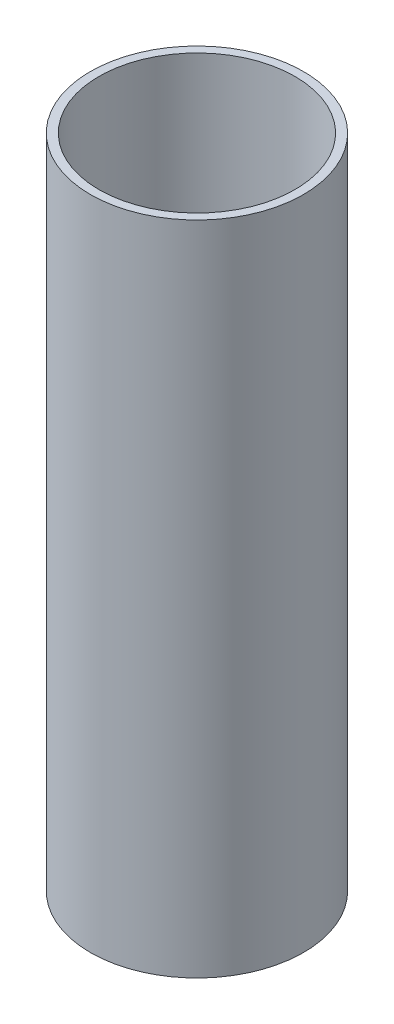
from build123d import *

# Parameters (mm, degrees)
SKETCH1_R           = 12.5
SKETCH1_R_2         = 11.5
BOSS_EXTRUDE1_DEPTH = 77


with BuildPart() as part:
    # Sketch1 → Boss-Extrude1 (new body)
    with BuildSketch(Plane(origin=(0, 0, 0), x_dir=(1, 0, 0), z_dir=(0, 1, 0))):
        with Locations(Location((0, 0, 0), (0, 0, 270))):
            Circle(SKETCH1_R)
        with Locations(Location((0, 0, 0), (0, 0, 270))):
            Circle(SKETCH1_R_2, mode=Mode.SUBTRACT)
    extrude(amount=BOSS_EXTRUDE1_DEPTH)


solid = part.part
